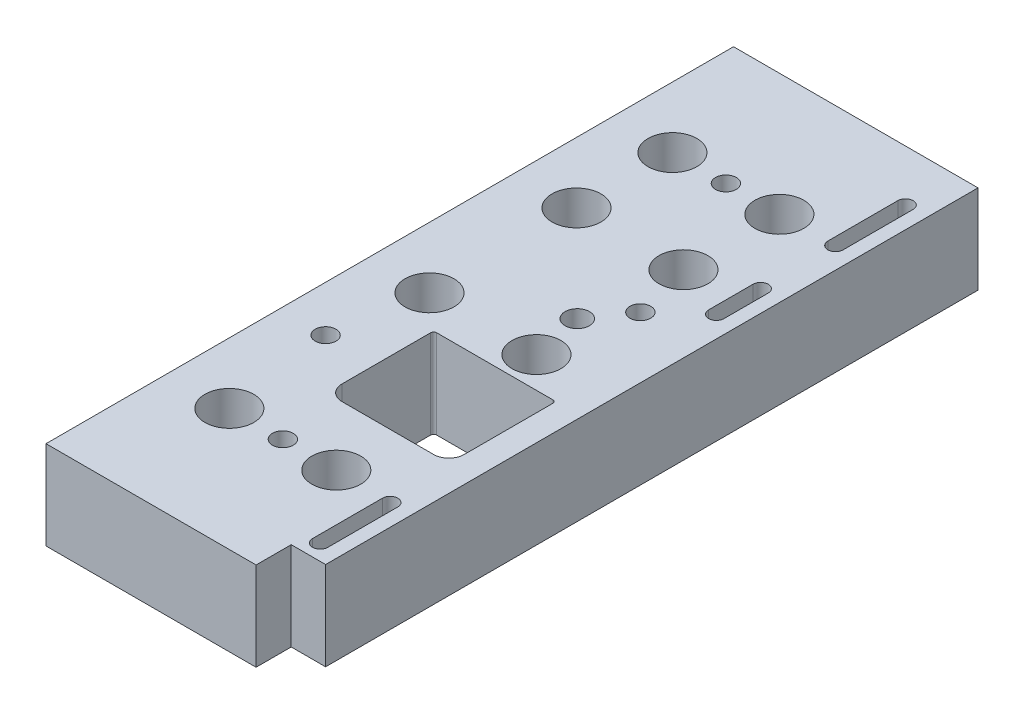
from build123d import *

# Parameters (mm, degrees)
SKETCH1_W             = 80
SKETCH1_H             = 225
BOSS_EXTRUDE1_DEPTH   = 29
CUT_EXTRUDE1_REACH    = 124.871
SKETCH3_R             = 8
CUT_EXTRUDE2_DEPTH    = 20
M8_TAPPED_HOLE1_D     = 6.8
M8_TAPPED_HOLE1_DEPTH = 19.75
M8_TAPPED_HOLE1_TIP   = 2.042926105
CUT_EXTRUDE3_REACH    = 124.871
SKETCH15_W            = 12
SKETCH15_H            = 11.5
SKETCH16_R            = 8.5
CUT_EXTRUDE4_DEPTH    = 5
CUT_EXTRUDE5_REACH    = 124.871
SKETCH17_R            = 4


with BuildPart() as part:
    # Sketch1 → Boss-Extrude1 (new body)
    with BuildSketch(Plane(origin=(0, 0, 0), x_dir=(1, 0, 0), z_dir=(0, 1, 0))):
        Rectangle(SKETCH1_W, SKETCH1_H)
    extrude(amount=-BOSS_EXTRUDE1_DEPTH)

    # Sketch2 → Cut-Extrude1 (cut, up to next)
    with BuildSketch(Plane(origin=(0, 0, 0), x_dir=(1, 0, 0), z_dir=(0, 1, 0)), mode=Mode.PRIVATE) as cut_extrude1_sk1:
        with BuildLine():
            Line((30.5, 72.87), (30.5, 95.77))
            ThreePointArc((30.5, 95.77), (33, 98.27), (35.5, 95.77))
            Line((35.5, 95.77), (35.5, 72.87))
            ThreePointArc((35.5, 72.87), (33, 70.37), (30.5, 72.87))
        make_face()
    cut_extrude1_tool1 = extrude(cut_extrude1_sk1.sketch, amount=-CUT_EXTRUDE1_REACH, mode=Mode.PRIVATE) & part.part
    # Sketch2 → Cut-Extrude1 (cut, up to next)
    with BuildSketch(Plane(origin=(0, 0, 0), x_dir=(1, 0, 0), z_dir=(0, 1, 0)), mode=Mode.PRIVATE) as cut_extrude1_sk2:
        with BuildLine():
            Line((30.5, 33.86), (30.5, 48.36))
            ThreePointArc((30.5, 48.36), (33, 50.86), (35.5, 48.36))
            Line((35.5, 48.36), (35.5, 33.86))
            ThreePointArc((35.5, 33.86), (33, 31.36), (30.5, 33.86))
        make_face()
    cut_extrude1_tool2 = extrude(cut_extrude1_sk2.sketch, amount=-CUT_EXTRUDE1_REACH, mode=Mode.PRIVATE) & part.part
    # Sketch2 → Cut-Extrude1 (cut, up to next)
    with BuildSketch(Plane(origin=(0, 0, 0), x_dir=(1, 0, 0), z_dir=(0, 1, 0)), mode=Mode.PRIVATE) as cut_extrude1_sk3:
        with BuildLine():
            Line((31.5, -47.14), (31.5, -18.14))
            ThreePointArc((31.5, -18.14), (31.207106781, -17.432893219), (30.5, -17.14))
            Line((30.5, -17.14), (-7.5, -17.14))
            ThreePointArc((-7.5, -17.14), (-8.207106781, -17.432893219), (-8.5, -18.14))
            Line((-8.5, -18.14), (-8.5, -47.14))
            ThreePointArc((-8.5, -47.14), (-7.035533906, -50.675533906), (-3.5, -52.14))
            Line((-3.5, -52.14), (26.5, -52.14))
            ThreePointArc((26.5, -52.14), (30.035533906, -50.675533906), (31.5, -47.14))
        make_face()
    cut_extrude1_tool3 = extrude(cut_extrude1_sk3.sketch, amount=-CUT_EXTRUDE1_REACH, mode=Mode.PRIVATE) & part.part
    # Sketch2 → Cut-Extrude1 (cut, up to next)
    with BuildSketch(Plane(origin=(0, 0, 0), x_dir=(1, 0, 0), z_dir=(0, 1, 0)), mode=Mode.PRIVATE) as cut_extrude1_sk4:
        with BuildLine():
            Line((30.5, -95.77), (30.5, -72.87))
            ThreePointArc((30.5, -72.87), (33, -70.37), (35.5, -72.87))
            Line((35.5, -72.87), (35.5, -95.77))
            ThreePointArc((35.5, -95.77), (33, -98.27), (30.5, -95.77))
        make_face()
    cut_extrude1_tool4 = extrude(cut_extrude1_sk4.sketch, amount=-CUT_EXTRUDE1_REACH, mode=Mode.PRIVATE) & part.part
    add(cut_extrude1_tool1.solids().sort_by_distance((33, 0, -84.32))[0], mode=Mode.SUBTRACT)
    add(cut_extrude1_tool2.solids().sort_by_distance((33, 0, -41.11))[0], mode=Mode.SUBTRACT)
    add(cut_extrude1_tool3.solids().sort_by_distance((11.5, 0, 34.518764))[0], mode=Mode.SUBTRACT)
    add(cut_extrude1_tool4.solids().sort_by_distance((33, 0, 84.32))[0], mode=Mode.SUBTRACT)

    # Sketch3 → Cut-Extrude2 (cut)
    with BuildSketch(Plane(origin=(0, 0, 0), x_dir=(1, 0, 0), z_dir=(0, 1, 0))):
        with Locations(Location((15, 72.5, 0), (0, 0, 270))):
            Circle(SKETCH3_R)
        with Locations(Location((15, 41.11, 0), (0, 0, 270))):
            Circle(SKETCH3_R)
        with Locations(Location((15, -7, 0), (0, 0, 270))):
            Circle(SKETCH3_R)
        with Locations(Location((15, -72.5, 0), (0, 0, 270))):
            Circle(SKETCH3_R)
        with Locations(Location((-20, -72.5, 0), (0, 0, 270))):
            Circle(SKETCH3_R)
        with Locations(Location((-20, -7, 0), (0, 0, 270))):
            Circle(SKETCH3_R)
        with Locations(Location((-20, 41.11, 0), (0, 0, 270))):
            Circle(SKETCH3_R)
        with Locations(Location((-20, 72.5, 0), (0, 0, 270))):
            Circle(SKETCH3_R)
    extrude(amount=-CUT_EXTRUDE2_DEPTH, mode=Mode.SUBTRACT)

    # M8 Tapped Hole1
    with Locations(Plane(origin=(0, 0, 0), x_dir=(1, 0, 0), z_dir=(0, 1, 0))):
        with Locations((-25, -36), (20, 22), (-2.5, 72.5), (-2.5, -72.5)):
            Hole(M8_TAPPED_HOLE1_D / 2, depth=M8_TAPPED_HOLE1_DEPTH)
            with Locations((0, 0, -(M8_TAPPED_HOLE1_DEPTH + M8_TAPPED_HOLE1_TIP / 2))):  # 118° drill point
                Cone(0, M8_TAPPED_HOLE1_D / 2, M8_TAPPED_HOLE1_TIP, mode=Mode.SUBTRACT)

    # Sketch15 → Cut-Extrude3 (cut, up to next)
    with BuildSketch(Plane(origin=(0, 0, 0), x_dir=(1, 0, 0), z_dir=(0, 1, 0)), mode=Mode.PRIVATE) as cut_extrude3_sk1:
        with Locations((34.75, -106.75)):
            Rectangle(SKETCH15_W, SKETCH15_H)
    cut_extrude3_tool1 = extrude(cut_extrude3_sk1.sketch, amount=-CUT_EXTRUDE3_REACH, mode=Mode.PRIVATE) & part.part
    add(cut_extrude3_tool1.solids().sort_by_distance((34.75, 0, 106.75))[0], mode=Mode.SUBTRACT)

    # Sketch16 → Cut-Extrude4 (cut)
    with BuildSketch(Plane.XZ.offset(29)):
        with Locations(Location((11.5, 100, 0), (0, 0, 270))):
            Circle(SKETCH16_R)
        with Locations(Location((11.5, -100, 0), (0, 0, 270))):
            Circle(SKETCH16_R)
    extrude(amount=-CUT_EXTRUDE4_DEPTH, mode=Mode.SUBTRACT)

    # Sketch17 → Cut-Extrude5 (cut, up to next)
    with BuildSketch(Plane(origin=(0, 0, 0), x_dir=(1, 0, 0), z_dir=(0, 1, 0)), mode=Mode.PRIVATE) as cut_extrude5_sk1:
        with Locations(Location((11.5, 9.86, 0), (0, 0, 270))):
            Circle(SKETCH17_R)
    cut_extrude5_tool1 = extrude(cut_extrude5_sk1.sketch, amount=-CUT_EXTRUDE5_REACH, mode=Mode.PRIVATE) & part.part
    add(cut_extrude5_tool1.solids().sort_by_distance((11.5, 0, -9.86))[0], mode=Mode.SUBTRACT)


solid = part.part
